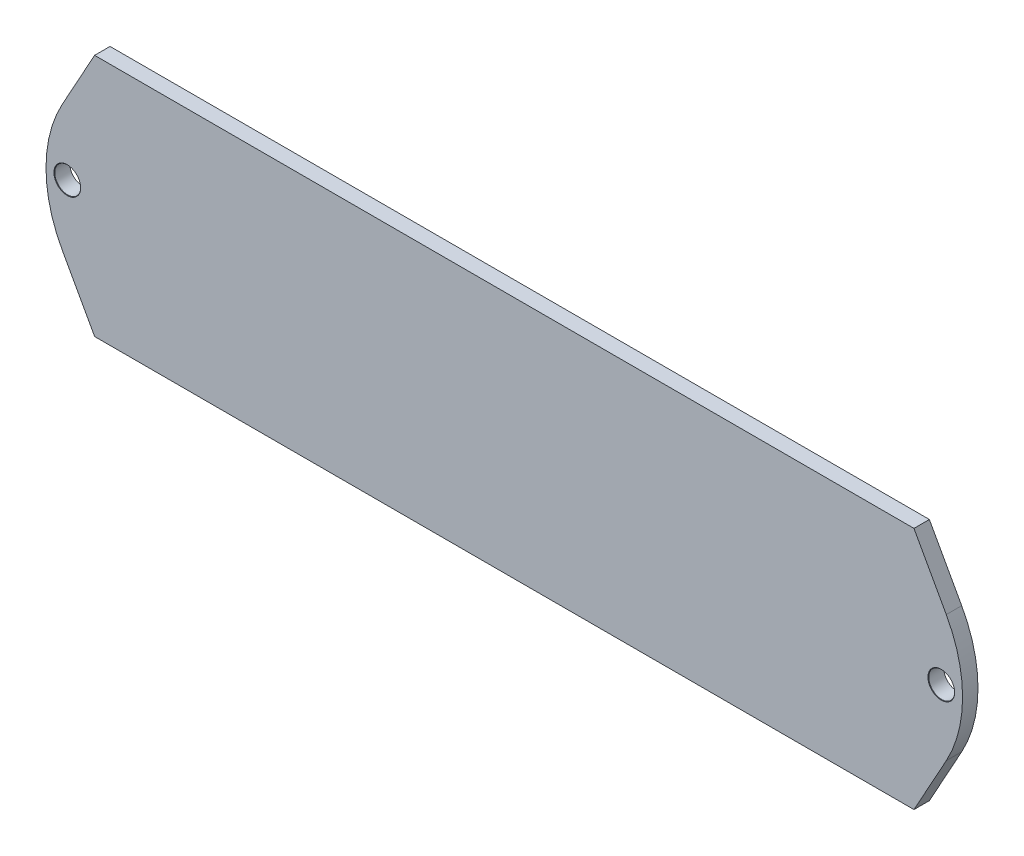
from build123d import *

# Parameters (mm, degrees)
BOSS_EXTRUDE1_DEPTH             = 1.905
F_3_0MM_DOWEL_HOLE1_D           = 3.2
F_3_0MM_DOWEL_HOLE1_CSINK_D     = 3.3
F_3_0MM_DOWEL_HOLE1_CSINK_ANGLE = 90


with BuildPart() as part:
    # Sketch1 → Boss-Extrude1 (new body)
    with BuildSketch(Plane.XY):
        with BuildLine():
            Line((-50.6, 15.04), (50.6, 15.04))
            Line((50.6, 15.04), (54.590317598, 7.813493896))
            ThreePointArc((54.590317598, 7.813493896), (56.604225159, 0), (54.590317598, -7.813493896))
            Line((54.590317598, -7.813493896), (50.6, -15.04))
            Line((50.6, -15.04), (-50.6, -15.04))
            Line((-50.6, -15.04), (-54.590317598, -7.813493896))
            ThreePointArc((-54.590317598, -7.813493896), (-56.604225159, 0), (-54.590317598, 7.813493896))
            Line((-54.590317598, 7.813493896), (-50.6, 15.04))
        make_face()
    extrude(amount=BOSS_EXTRUDE1_DEPTH)

    # Ø3.0mm Dowel Hole1 (through all)
    with Locations(Plane.XY.offset(1.905)):
        with Locations((53.975, 0), (-53.975, 0)):
            CounterSinkHole(F_3_0MM_DOWEL_HOLE1_D / 2, F_3_0MM_DOWEL_HOLE1_CSINK_D / 2, counter_sink_angle=F_3_0MM_DOWEL_HOLE1_CSINK_ANGLE)


solid = part.part
